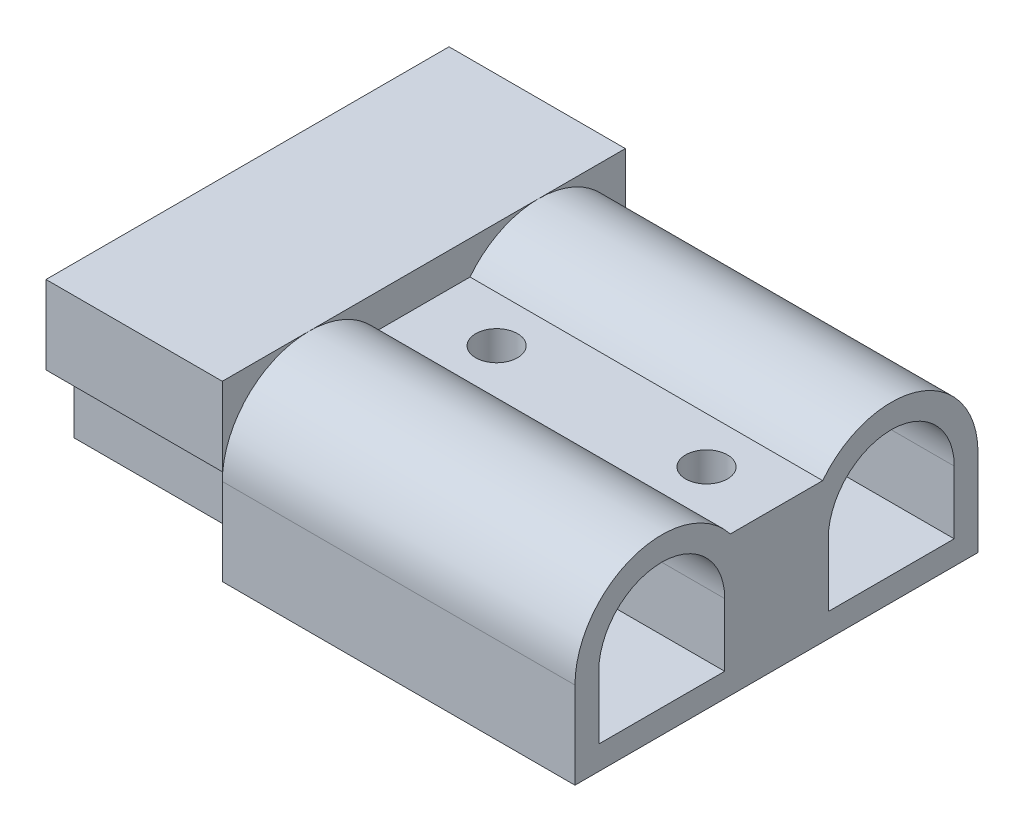
from build123d import *

# Parameters (mm, degrees)
SKETCH1_W              = 16.002
SKETCH1_H              = 36.576
BOSS_EXTRUDE1_DEPTH    = 7.112
BOSS_EXTRUDE2_DEPTH    = 6.604
SKETCH3_W              = 16.002
SKETCH3_H              = 6.604
CUT_EXTRUDE1_DEPTH     = 2.54
SKETCH4_W              = 16.002
SKETCH4_H              = 2.54
CUT_EXTRUDE2_DEPTH     = 6.604
BOSS_EXTRUDE3_DEPTH    = 32.004
SKETCH6_W              = 32.004
SKETCH6_H              = 36.576
BOSS_EXTRUDE4_DEPTH    = 2.032
SKETCH7_W              = 16.002
SKETCH7_H              = 2.54
CUT_EXTRUDE3_DEPTH     = 6.604
M3_5_CLEARANCE_HOLE1_D = 3.7973


with BuildPart() as part:
    # Sketch1 → Boss-Extrude1 (new body)
    with BuildSketch(Plane(origin=(0, 7.874, 0), x_dir=(1, 0, 0), z_dir=(0, 1, 0))):
        with Locations((-8.001, 0)):
            Rectangle(SKETCH1_W, SKETCH1_H)
    extrude(amount=-BOSS_EXTRUDE1_DEPTH)

    # Sketch2 → Boss-Extrude2 (add)
    with BuildSketch(Plane.XZ.offset(-0.762)):
        with BuildLine():
            Line((-16.002, -18.288), (-16.002, 18.288))
            Line((-16.002, 18.288), (0, 18.288))
            Line((0, 18.288), (0, -15.748))
            add(Edge.make_bspline(
                [(0, -18.288), (0, -17.441333333), (0, -16.594666667), (0, -15.748)],
                knots=[0, 0, 0, 0, 1, 1, 1, 1], degree=3))
            Line((0, -18.288), (-16.002, -18.288))
        make_face()
    extrude(amount=BOSS_EXTRUDE2_DEPTH)

    # Sketch3 → Cut-Extrude1 (cut)
    with BuildSketch(Plane(origin=(0, 0, -18.288), x_dir=(-1, 0, 0), z_dir=(0, 0, -1))):
        with Locations((8.001, -2.54)):
            Rectangle(SKETCH3_W, SKETCH3_H)
    extrude(amount=-CUT_EXTRUDE1_DEPTH, mode=Mode.SUBTRACT)

    # Sketch4 → Cut-Extrude2 (cut)
    with BuildSketch(Plane.XZ.offset(5.842)):
        with Locations((-8.001, 17.018)):
            Rectangle(SKETCH4_W, SKETCH4_H)
    extrude(amount=-CUT_EXTRUDE2_DEPTH, mode=Mode.SUBTRACT)

    # Sketch5 → Boss-Extrude3 (add)
    with BuildSketch(Plane(origin=(0, 0, 0), x_dir=(0, 0, -1), z_dir=(1, 0, 0))):
        with BuildLine():
            Line((-18.288, -5.842), (-18.288, 0))
            ThreePointArc((-18.288, 0), (-12.964507707, 7.449482293), (-4.192296053, 4.826))
            Line((-4.192296053, 4.826), (4.192296053, 4.826))
            ThreePointArc((4.192296053, 4.826), (12.964507707, 7.449482293), (18.288, 0))
            Line((18.288, 0), (18.288, -5.842))
            Line((18.288, -5.842), (-18.288, -5.842))
        make_face()
        with BuildLine():
            Line((4.699, 0), (4.699, -5.715))
            Line((4.699, -5.715), (16.129, -5.715))
            Line((16.129, -5.715), (16.129, 0))
            ThreePointArc((16.129, 0), (10.414, 5.715), (4.699, 0))
        make_face(mode=Mode.SUBTRACT)
        with BuildLine():
            Line((-16.129, 0), (-16.129, -5.715))
            Line((-16.129, -5.715), (-4.699, -5.715))
            Line((-4.699, -5.715), (-4.699, 0))
            ThreePointArc((-4.699, 0), (-10.414, 5.715), (-16.129, 0))
        make_face(mode=Mode.SUBTRACT)
    extrude(amount=BOSS_EXTRUDE3_DEPTH)

    # Sketch6 → Boss-Extrude4 (add)
    with BuildSketch(Plane.XZ.offset(5.842)):
        with Locations((16.002, 0)):
            Rectangle(SKETCH6_W, SKETCH6_H)
    extrude(amount=BOSS_EXTRUDE4_DEPTH)

    # Sketch7 → Cut-Extrude3 (cut)
    with BuildSketch(Plane.XZ.offset(5.842)):
        with Locations((-8.001, 0)):
            Rectangle(SKETCH7_W, SKETCH7_H)
    extrude(amount=-CUT_EXTRUDE3_DEPTH, mode=Mode.SUBTRACT)

    # M3.5 Clearance Hole1 (through all)
    with Locations(Plane(origin=(0, 4.826, 0), x_dir=(1, 0, 0), z_dir=(0, 1, 0))):
        with Locations((25.654, 0), (6.604, 0)):
            Hole(M3_5_CLEARANCE_HOLE1_D / 2)


solid = part.part
